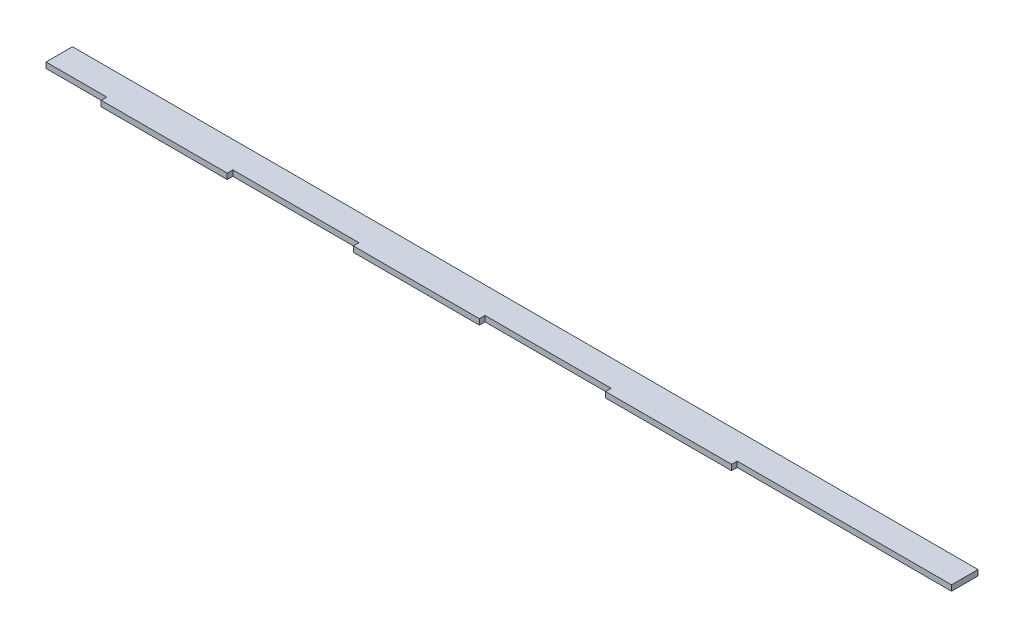
from build123d import *

# Parameters (mm, degrees)
BOSS_EXTRUDE1_DEPTH = 3.175


with BuildPart() as part:
    # Sketch1 → Boss-Extrude1 (new body)
    with BuildSketch(Plane(origin=(0, 0, 0), x_dir=(1, 0, 0), z_dir=(0, 1, 0))):
        Polygon((15.557142857, 0), (15.557142857, 15), (528.557142857, 15), (528.557142857, 0), (407.128571429, 0), (407.128571429, -3.175), (335.7, -3.175), (335.7, 0), (264.271428571, 0), (264.271428571, -3.175), (192.842857143, -3.175), (192.842857143, 0), (121.414285714, 0), (121.414285714, -3.175), (49.985714286, -3.175), (49.985714286, 0), align=None)
    extrude(amount=BOSS_EXTRUDE1_DEPTH)


solid = part.part
